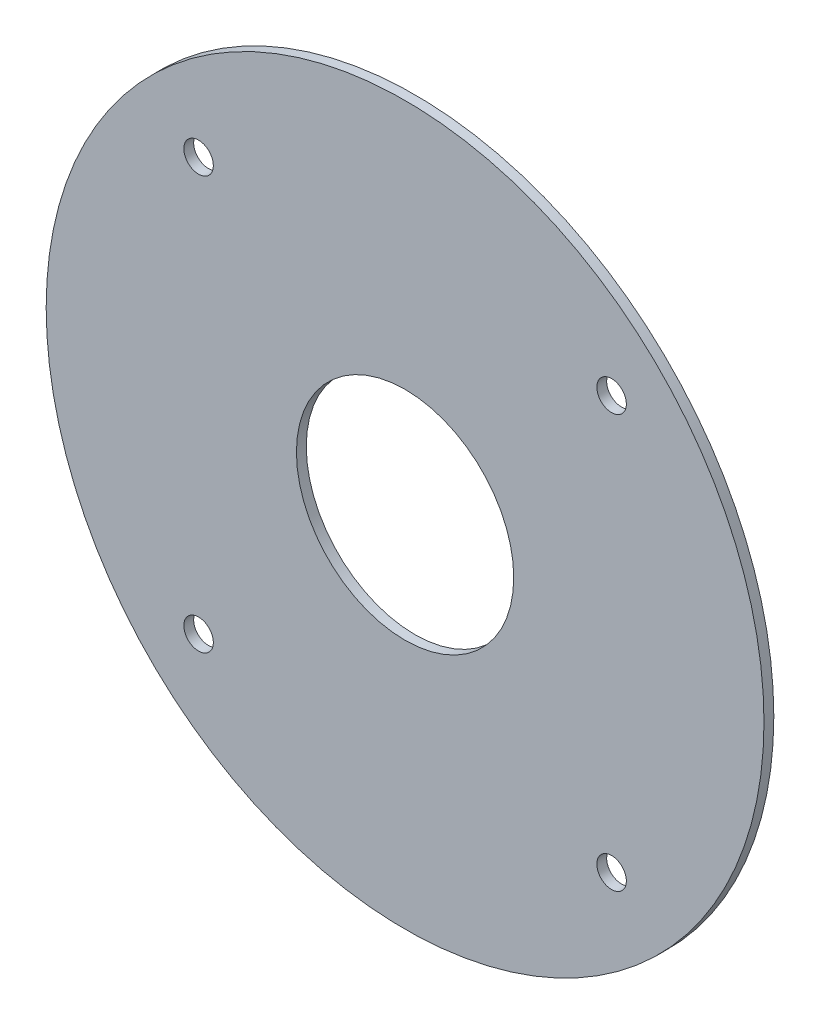
from build123d import *

# Parameters (mm, degrees)
SKETCH_1_R      = 36.5
SKETCH_1_R_2    = 11.05
SKETCH_1_R_3    = 1.5
EXTRUDE_1_DEPTH = 1


with BuildPart() as part:
    # 草图1 → 凸台-拉伸1 (new body)
    with BuildSketch(Plane.XY):
        with Locations((-96.079749173, -54.763714641)):
            Circle(SKETCH_1_R)
        with Locations((-96.079749173, -54.763714641)):
            Circle(SKETCH_1_R_2, mode=Mode.SUBTRACT)
        with Locations((-117.080820574, -33.76264324)):
            Circle(SKETCH_1_R_3, mode=Mode.SUBTRACT)
        with Locations((-117.080820574, -75.764786042)):
            Circle(SKETCH_1_R_3, mode=Mode.SUBTRACT)
        with Locations((-75.078677772, -75.764786042)):
            Circle(SKETCH_1_R_3, mode=Mode.SUBTRACT)
        with Locations((-75.078677772, -33.76264324)):
            Circle(SKETCH_1_R_3, mode=Mode.SUBTRACT)
    extrude(amount=EXTRUDE_1_DEPTH)


solid = part.part
